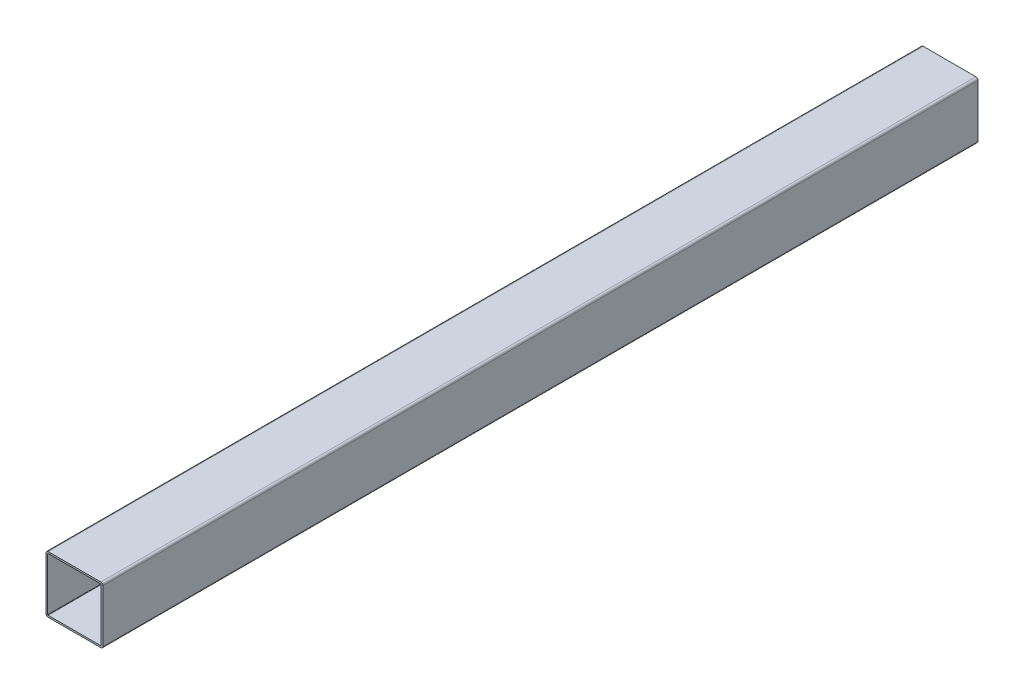
from build123d import *

# Parameters (mm, degrees)
STRUCTURAL_MEMBER1_DEPTH = 615


with BuildPart() as part:
    # Sketch12 → Structural Member1 (new body)
    with BuildSketch(Plane(origin=(0, 0, 0), x_dir=(-1, 0, 0), z_dir=(0, 0, -1))):
        with BuildLine():
            Line((-18.5, -20), (18.5, -20))
            ThreePointArc((18.5, -20), (19.560660172, -19.560660172), (20, -18.5))
            Line((20, -18.5), (20, 18.5))
            ThreePointArc((20, 18.5), (19.560660172, 19.560660172), (18.5, 20))
            Line((18.5, 20), (-18.5, 20))
            ThreePointArc((-18.5, 20), (-19.560660172, 19.560660172), (-20, 18.5))
            Line((-20, 18.5), (-20, -18.5))
            ThreePointArc((-20, -18.5), (-19.560660172, -19.560660172), (-18.5, -20))
        make_face()
        with BuildLine():
            Line((-18.5, -18.8), (18.5, -18.8))
            ThreePointArc((18.5, -18.8), (18.712132034, -18.712132034), (18.8, -18.5))
            Line((18.8, -18.5), (18.8, 18.5))
            ThreePointArc((18.8, 18.5), (18.712132034, 18.712132034), (18.5, 18.8))
            Line((18.5, 18.8), (-18.5, 18.8))
            ThreePointArc((-18.5, 18.8), (-18.712132034, 18.712132034), (-18.8, 18.5))
            Line((-18.8, 18.5), (-18.8, -18.5))
            ThreePointArc((-18.8, -18.5), (-18.712132034, -18.712132034), (-18.5, -18.8))
        make_face(mode=Mode.SUBTRACT)
    extrude(amount=STRUCTURAL_MEMBER1_DEPTH)


solid = part.part
